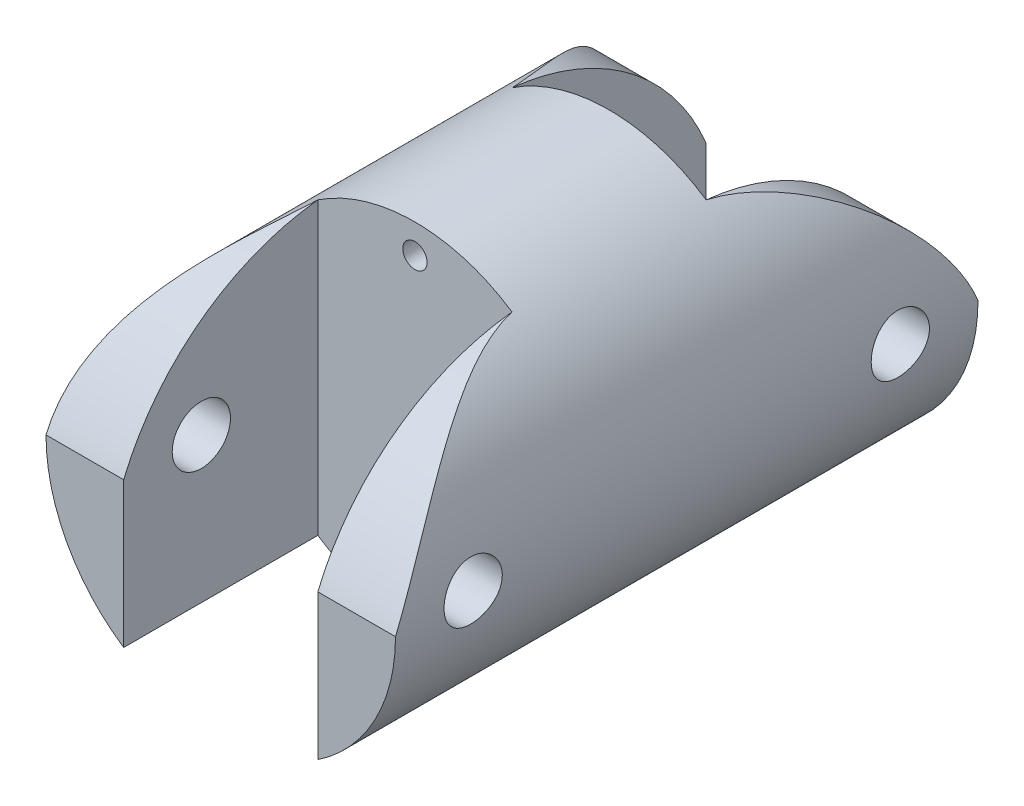
from build123d import *

# Parameters (mm, degrees)
SKETCH1_R           = 9
BOSS_EXTRUDE1_DEPTH = 30
SKETCH2_W           = 10
SKETCH2_H           = 10
CUT_EXTRUDE1_DEPTH  = 33.588341474
CUT_EXTRUDE3_DEPTH  = 33.588341474
CUT_EXTRUDE4_START  = -8
SKETCH4_R           = 1.5
CUT_EXTRUDE4_DEPTH  = 41.588341621
SKETCH6_R           = 0.625
CUT_EXTRUDE5_DEPTH  = 10
CUT_EXTRUDE6_REACH  = 25.707
SKETCH7_W           = 3
SKETCH7_H           = 2
SKETCH8_R           = 0.9
CUT_EXTRUDE7_DEPTH  = 5


with BuildPart() as part:
    # Sketch1 → Boss-Extrude1 (new body)
    with BuildSketch(Plane.XY):
        Circle(SKETCH1_R)
    extrude(amount=-BOSS_EXTRUDE1_DEPTH)

    # Sketch2 → Cut-Extrude1 (cut, symmetric)
    with BuildSketch(Plane(origin=(0, 0, 0), x_dir=(1, 0, 0), z_dir=(0, 1, 0))):
        with Locations((0, 25)):
            Rectangle(SKETCH2_W, SKETCH2_H)
    cut_extrude1 = extrude(amount=CUT_EXTRUDE1_DEPTH, both=True, mode=Mode.SUBTRACT)

    # Sketch5 → Cut-Extrude3 (cut, symmetric)
    with BuildSketch(Plane(origin=(0, 0, 0), x_dir=(0, 0, -1), z_dir=(1, 0, 0))):
        with BuildLine():
            Line((20, 7.483314774), (30, 7.483314774))
            Line((30, 7.483314774), (30, 0))
            ThreePointArc((30, 0), (26.031389946, 5.119910176), (20, 7.483314774))
        make_face()
    cut_extrude3 = extrude(amount=CUT_EXTRUDE3_DEPTH, both=True, mode=Mode.SUBTRACT)

    # Sketch4 → Cut-Extrude4 (cut)
    with BuildSketch(Plane(origin=(0, 0, 0), x_dir=(0, 0, -1), z_dir=(1, 0, 0)).offset(CUT_EXTRUDE4_START)):
        with Locations((26, 0)):
            Circle(SKETCH4_R)
    cut_extrude4 = extrude(amount=CUT_EXTRUDE4_DEPTH, mode=Mode.SUBTRACT)

    # Mirror1: Cut-Extrude1, Cut-Extrude3, Cut-Extrude4 across plane
    add(cut_extrude1.mirror(Plane.XY.offset(-15)), mode=Mode.SUBTRACT)
    add(cut_extrude3.mirror(Plane.XY.offset(-15)), mode=Mode.SUBTRACT)
    add(cut_extrude4.mirror(Plane.XY.offset(-15)), mode=Mode.SUBTRACT)

    # Sketch6 → Cut-Extrude5 (cut)
    with BuildSketch(Plane.XY.offset(-10)):
        with Locations((0, 7.5)):
            Circle(SKETCH6_R)
    extrude(amount=-CUT_EXTRUDE5_DEPTH, mode=Mode.SUBTRACT)

    # Sketch7 → Cut-Extrude6 (cut, up to next)
    with BuildSketch(Plane.XY.offset(-10), mode=Mode.PRIVATE) as cut_extrude6_sk1:
        with Locations((0, -9)):
            Rectangle(SKETCH7_W, SKETCH7_H)
    cut_extrude6_tool1 = extrude(cut_extrude6_sk1.sketch, amount=-CUT_EXTRUDE6_REACH, mode=Mode.PRIVATE) & part.part
    add(cut_extrude6_tool1.solids().sort_by_distance((0, -9, -10))[0], mode=Mode.SUBTRACT)

    # Sketch8 → Cut-Extrude7 (cut)
    with BuildSketch(Plane.XZ.offset(8)):
        with Locations(Location((0, -15, 0), (0, 0, 270))):
            Circle(SKETCH8_R)
    extrude(amount=-CUT_EXTRUDE7_DEPTH, mode=Mode.SUBTRACT)


solid = part.part
